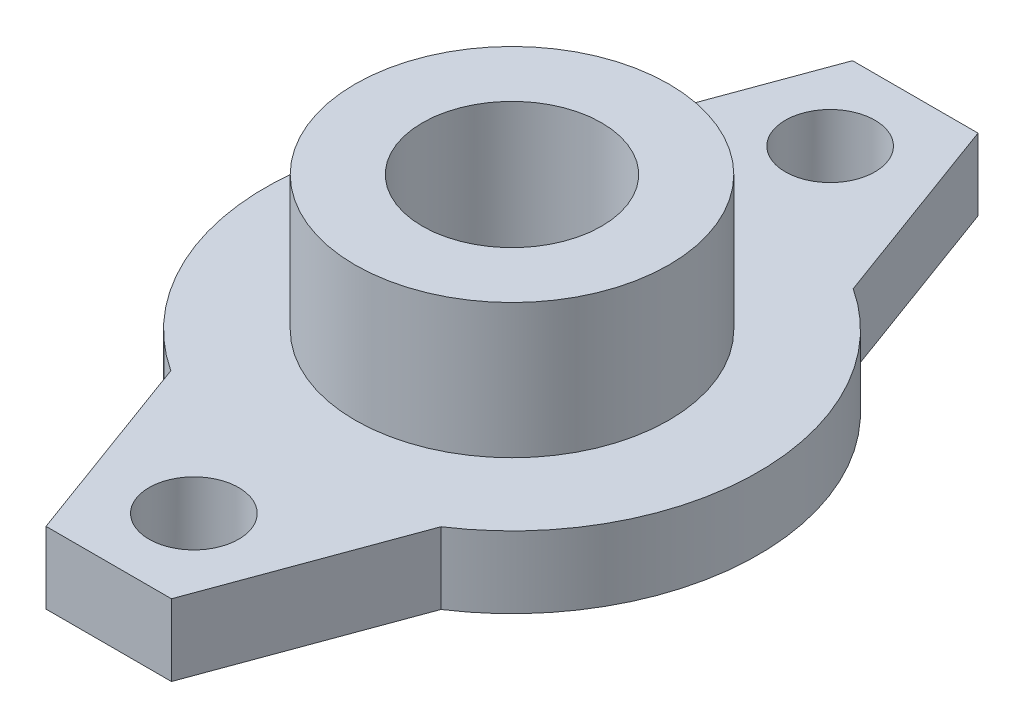
from build123d import *

# Parameters (mm, degrees)
BOSS_EXTRU_1_DEPTH      = 8
ESQUISSE2_R             = 17.5
ESQUISSE2_R_2           = 10
BOSS_EXTRU_2_DEPTH      = 15
ENL_V_START             = -10
ESQUISSE3_R             = 10
ENL_V_MAT_EXTRU_1_DEPTH = 10
ESQUISSE4_R             = 5
ENL_V_MAT_EXTRU_2_DEPTH = 10


with BuildPart() as part:
    # Esquisse1 → Boss.-Extru.1 (new body)
    with BuildSketch(Plane(origin=(0, 0, 0), x_dir=(1, 0, 0), z_dir=(0, 1, 0))):
        with BuildLine():
            Line((-15.074813432, 23), (-7, 45))
            Line((-7, 45), (7, 45))
            Line((7, 45), (15.074813432, 23))
            ThreePointArc((15.074813432, 23), (27.5, 0), (15.074813432, -23))
            Line((15.074813432, -23), (7, -45))
            Line((7, -45), (-7, -45))
            Line((-7, -45), (-15.074813432, -23))
            ThreePointArc((-15.074813432, -23), (-27.5, 0), (-15.074813432, 23))
        make_face()
    extrude(amount=BOSS_EXTRU_1_DEPTH)

    # Esquisse2 → Boss.-Extru.2 (add)
    with BuildSketch(Plane(origin=(0, 8, 0), x_dir=(1, 0, 0), z_dir=(0, 1, 0))):
        with Locations(Location((0, 0, 0), (0, 0, 90))):
            Circle(ESQUISSE2_R)
        with Locations(Location((0, 0, 0), (0, 0, 270))):
            Circle(ESQUISSE2_R_2, mode=Mode.SUBTRACT)
    extrude(amount=BOSS_EXTRU_2_DEPTH)

    # Esquisse3 → Enlèv. mat.-Extru.1 (cut)
    with BuildSketch(Plane(origin=(0, 8, 0), x_dir=(1, 0, 0), z_dir=(0, 1, 0)).offset(ENL_V_START)):
        with Locations(Location((0, 0, 0), (0, 0, 90))):
            Circle(ESQUISSE3_R)
    extrude(amount=ENL_V_MAT_EXTRU_1_DEPTH, mode=Mode.SUBTRACT)

    # Esquisse4 → Enlèv. mat.-Extru.2 (cut)
    with BuildSketch(Plane(origin=(0, 8, 0), x_dir=(1, 0, 0), z_dir=(0, 1, 0))):
        with Locations(Location((0, 35.5, 0), (0, 0, 270))):
            Circle(ESQUISSE4_R)
        with Locations(Location((0, -35.5, 0), (0, 0, 270))):
            Circle(ESQUISSE4_R)
    extrude(amount=-ENL_V_MAT_EXTRU_2_DEPTH, mode=Mode.SUBTRACT)


solid = part.part
